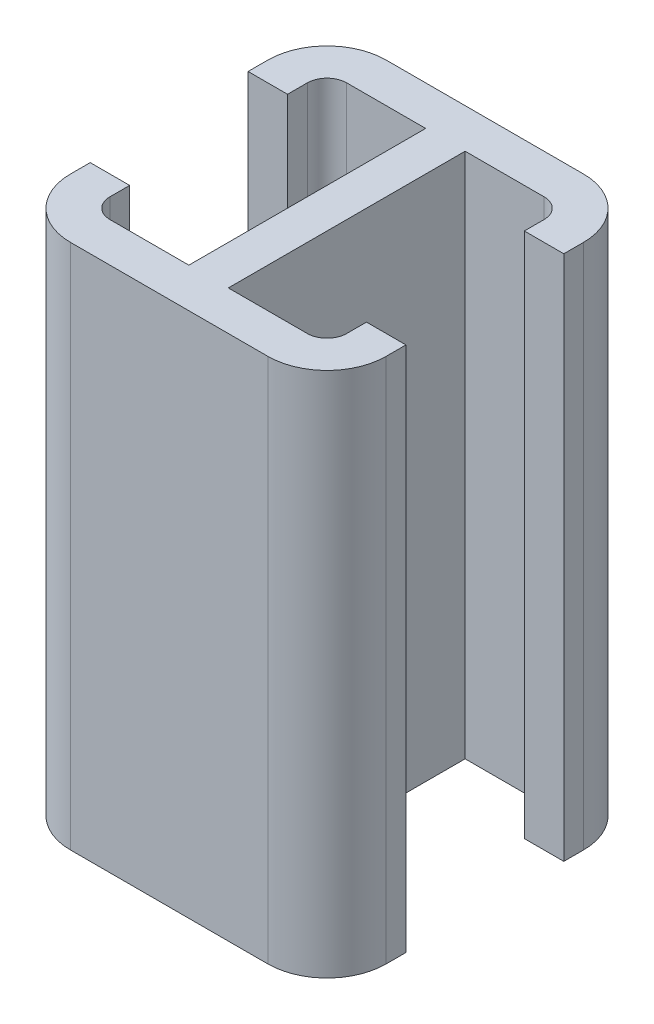
from build123d import *

# Parameters (mm, degrees)
EXTRUDE_1_DEPTH = 200
FILLET_1_R      = 22.5
FILLET_2_R      = 7.5


with BuildPart() as part:
    # ｽｹｯﾁ5 → ﾎﾞｽ - 押し出し1 (new body)
    with BuildSketch(Plane(origin=(0, 0, 0), x_dir=(1, 0, 0), z_dir=(0, 1, 0))):
        Polygon((0, 0), (120, 0), (120, 30), (105, 30), (105, 15), (67.5, 15), (67.5, 105), (105, 105), (105, 90), (120, 90), (120, 120), (0, 120), (0, 90), (15, 90), (15, 105), (52.5, 105), (52.5, 15), (15, 15), (15, 30), (0, 30), align=None)
    extrude(amount=EXTRUDE_1_DEPTH)

    # ﾌｨﾚｯﾄ1
    fillet_1_edges = [part.edges().sort_by_distance(p)[0] for p in [
        (0, 100, -120),
        (120, 100, -120),
        (120, 100, 0),
        (0, 100, 0),
    ]]
    fillet(fillet_1_edges, radius=FILLET_1_R)

    # ﾌｨﾚｯﾄ2
    fillet_2_edges = [part.edges().sort_by_distance(p)[0] for p in [
        (15, 100, -15),
        (15, 100, -105),
        (105, 100, -105),
        (105, 100, -15),
    ]]
    fillet(fillet_2_edges, radius=FILLET_2_R)


solid = part.part
